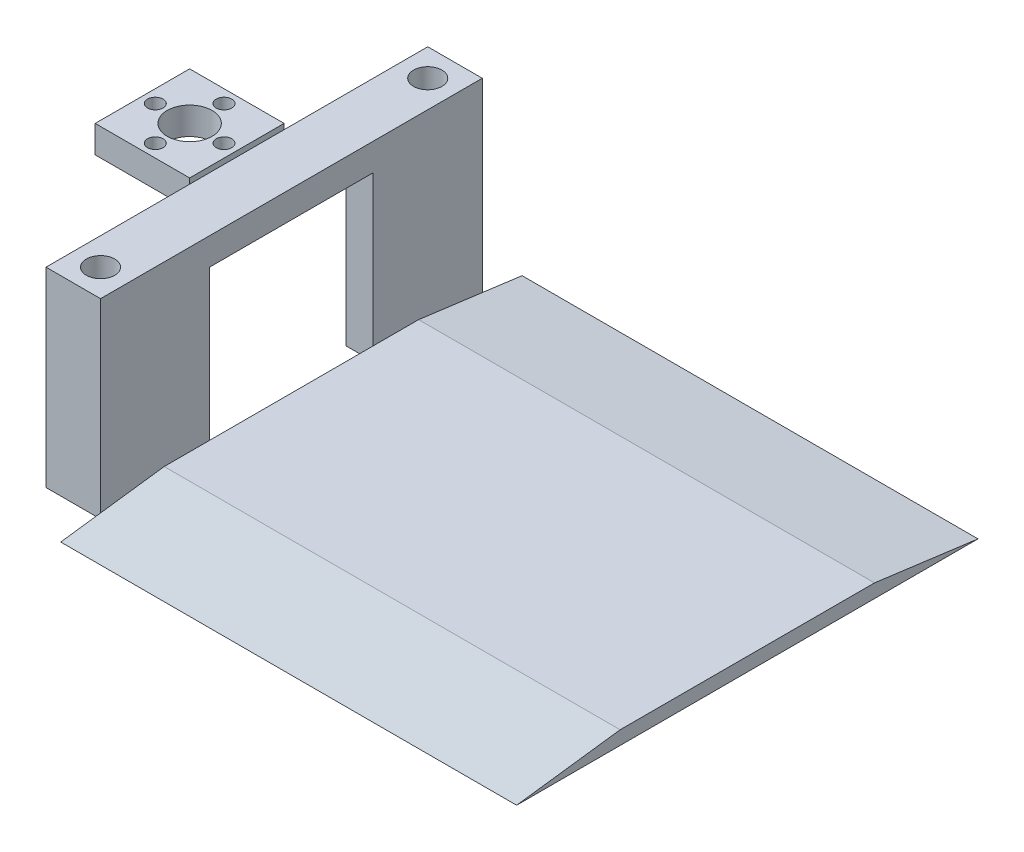
from build123d import *

# Parameters (mm, degrees)
SKETCH1_W           = 106.172
SKETCH1_H           = 107.442
BOSS_EXTRUDE1_DEPTH = 3.175
SKETCH3_W           = 12.7
SKETCH3_H           = 12.7
SKETCH3_R           = 3.302
BOSS_EXTRUDE2_DEPTH = 44.45
CUT_EXTRUDE1_DEPTH  = 106.172
SKETCH6_W           = 12.7
SKETCH6_H           = 6.35
BOSS_EXTRUDE3_DEPTH = 63.5
BOSS_EXTRUDE5_START = 1.27
SKETCH11_W          = 21.999999942
SKETCH11_H          = 21.999999942
SKETCH11_R          = 5.22699996
SKETCH11_R_2        = 1.813500056
BOSS_EXTRUDE5_DEPTH = 6.35
SKETCH12_W          = 6.35
SKETCH12_H          = 12.7
BOSS_EXTRUDE6_DEPTH = 38.1


with BuildPart() as part:
    # Sketch1 → Boss-Extrude1 (new body)
    with BuildSketch(Plane(origin=(0, 0, 0), x_dir=(1, 0, 0), z_dir=(0, 1, 0))):
        with Locations((53.086, 53.721)):
            Rectangle(SKETCH1_W, SKETCH1_H)
    extrude(amount=BOSS_EXTRUDE1_DEPTH)

    # Sketch3 → Boss-Extrude2 (add)
    # profile 1 of 2: a face of its own
    with BuildSketch(Plane(origin=(0, 0, 0), x_dir=(1, 0, 0), z_dir=(0, 1, 0))):
        with Locations((-6.35, 91.821)):
            Rectangle(SKETCH3_W, SKETCH3_H)
        with Locations(Location((-6.35, 91.821, 0), (0, 0, 270))):
            Circle(SKETCH3_R, mode=Mode.SUBTRACT)
    # profile 2 of 2: a face of its own
    with BuildSketch(Plane(origin=(0, 0, 0), x_dir=(1, 0, 0), z_dir=(0, 1, 0))):
        with Locations((-6.35, 15.621)):
            Rectangle(SKETCH3_W, SKETCH3_H)
        with Locations(Location((-6.35, 15.621, 0), (0, 0, 90))):
            Circle(SKETCH3_R, mode=Mode.SUBTRACT)
    extrude(amount=BOSS_EXTRUDE2_DEPTH)

    # Sketch4 → Cut-Extrude1 (cut)
    with BuildSketch(Plane(origin=(106.172, 0, 0), x_dir=(0, 0, -1), z_dir=(1, 0, 0))):
        Polygon((0, 0), (24.096533231, 3.175), (0, 3.175), align=None)
        Polygon((107.442, 3.175), (107.442, 0), (83.345466769, 3.175), align=None)
    extrude(amount=-CUT_EXTRUDE1_DEPTH, mode=Mode.SUBTRACT)

    # Sketch6 → Boss-Extrude3 (add)
    with BuildSketch(Plane.XY.offset(-85.471)):
        with Locations((-6.35, 41.275)):
            Rectangle(SKETCH6_W, SKETCH6_H)
    extrude(amount=BOSS_EXTRUDE3_DEPTH)

    # Sketch11 → Boss-Extrude5 (add)
    with BuildSketch(Plane(origin=(0, 44.45, 0), x_dir=(1, 0, 0), z_dir=(0, 1, 0)).offset(BOSS_EXTRUDE5_START)):
        with Locations((-23.699999971, 53.721)):
            Rectangle(SKETCH11_W, SKETCH11_H)
        with Locations(Location((-23.699999971, 53.721, 0), (0, 0, 270))):
            Circle(SKETCH11_R, mode=Mode.SUBTRACT)
        with Locations(Location((-23.699999971, 61.721000002, 0), (0, 0, 270))):
            Circle(SKETCH11_R_2, mode=Mode.SUBTRACT)
        with Locations(Location((-15.699999969, 53.721, 0), (0, 0, 270))):
            Circle(SKETCH11_R_2, mode=Mode.SUBTRACT)
        with Locations(Location((-23.699999971, 45.720999998, 0), (0, 0, 270))):
            Circle(SKETCH11_R_2, mode=Mode.SUBTRACT)
        with Locations(Location((-31.699999973, 53.721, 0), (0, 0, 270))):
            Circle(SKETCH11_R_2, mode=Mode.SUBTRACT)
    extrude(amount=-BOSS_EXTRUDE5_DEPTH)

    # Sketch12 → Boss-Extrude6 (add)
    with BuildSketch(Plane.XZ):
        with Locations((-3.175, -28.321)):
            Rectangle(SKETCH12_W, SKETCH12_H)
        with Locations((-3.175, -79.121)):
            Rectangle(SKETCH12_W, SKETCH12_H)
    extrude(amount=-BOSS_EXTRUDE6_DEPTH)


solid = part.part
